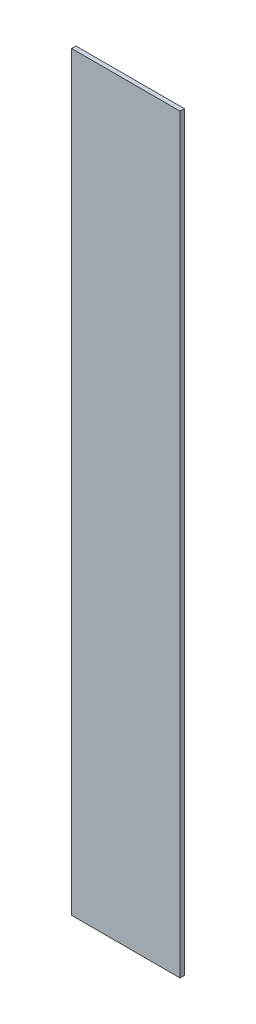
from build123d import *

# Parameters (mm, degrees)
BOSS_EXTRUDE1_DEPTH      = 200
BOSS_EXTRUDE1_DEPTH_BACK = 146
SKETCH1_W                = 50
SKETCH1_H                = 2


with BuildPart() as part:
    # Sketch1 → Boss-Extrude1 (new, two sides: drawn at the far end of the back side and taken through both)
    with BuildSketch(Plane(origin=(0, 0, 0), x_dir=(1, 0, 0), z_dir=(0, 1, 0)).offset(-BOSS_EXTRUDE1_DEPTH_BACK)):
        Rectangle(SKETCH1_W, SKETCH1_H)
    extrude(amount=BOSS_EXTRUDE1_DEPTH + BOSS_EXTRUDE1_DEPTH_BACK)


solid = part.part
